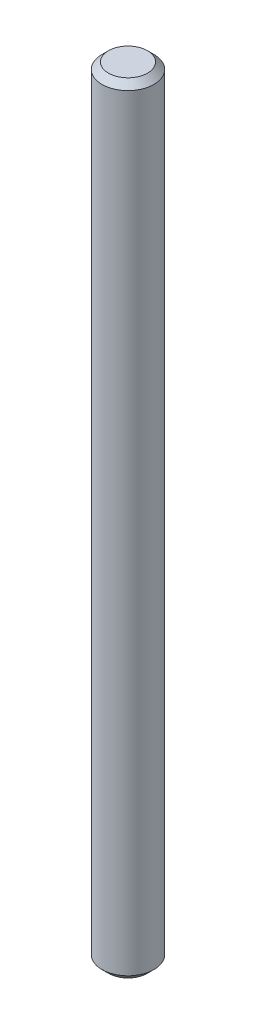
from build123d import *

# Parameters (mm, degrees)
SKETCH_1_R      = 4
EXTRUDE_1_DEPTH = 120
CHAMFER_1_SIZE  = 1


with BuildPart() as part:
    # 草圖1 → 填料-伸長1 (new body)
    with BuildSketch(Plane(origin=(0, 0, 0), x_dir=(1, 0, 0), z_dir=(0, 1, 0))):
        with Locations(Location((0, 0, 0), (0, 0, 270))):
            Circle(SKETCH_1_R)
    extrude(amount=EXTRUDE_1_DEPTH)

    # 導角1
    chamfer_1_edges = [part.edges().sort_by_distance(p)[0] for p in [
        (0, 0, -4),
        (0, 120, -4),
    ]]
    chamfer(chamfer_1_edges, length=CHAMFER_1_SIZE)


solid = part.part
